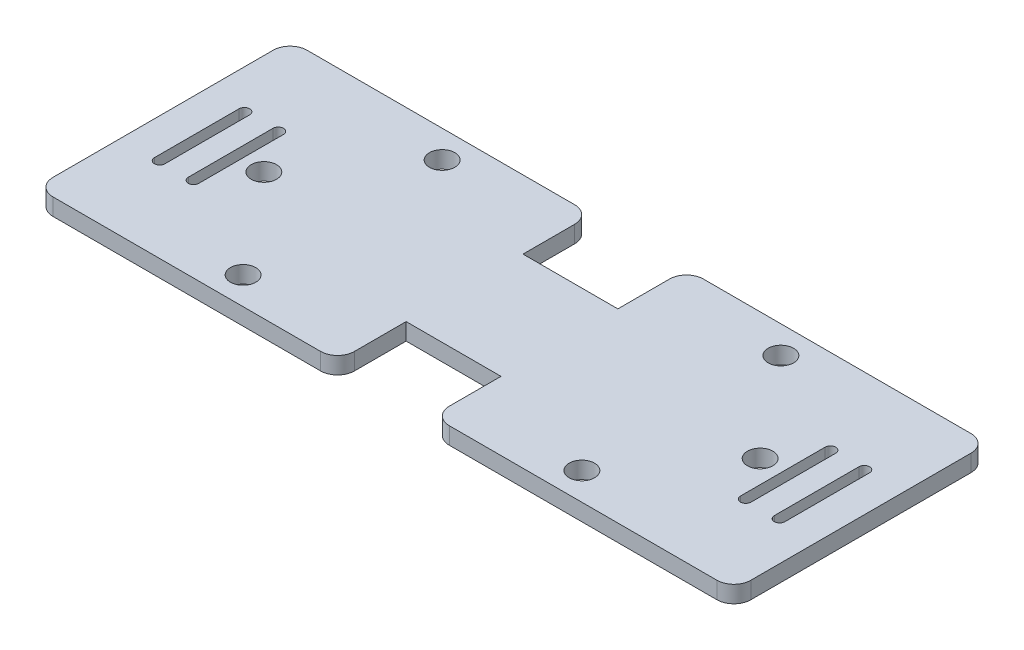
from build123d import *

# Parameters (mm, degrees)
SKETCH_1_R      = 1.5
EXTRUDE_1_DEPTH = 2


with BuildPart() as part:
    # 草图1 → 凸台-拉伸1 (new body)
    with BuildSketch(Plane(origin=(0, 0, 0), x_dir=(1, 0, 0), z_dir=(0, 1, 0))):
        with BuildLine():
            Line((-5.6, 6.9), (-5.6, 13))
            ThreePointArc((-5.6, 13), (-6.185786438, 14.414213562), (-7.6, 15))
            Line((-7.6, 15), (-39.2, 15))
            ThreePointArc((-39.2, 15), (-40.614213562, 14.414213562), (-41.2, 13))
            Line((-41.2, 13), (-41.2, -13))
            ThreePointArc((-41.2, -13), (-40.614213562, -14.414213562), (-39.2, -15))
            Line((-39.2, -15), (-7.6, -15))
            ThreePointArc((-7.6, -15), (-6.185786438, -14.414213562), (-5.6, -13))
            Line((-5.6, -13), (-5.6, -6.9))
            Line((-5.6, -6.9), (5.6, -6.9))
            Line((5.6, -6.9), (5.6, -13))
            ThreePointArc((5.6, -13), (6.185786438, -14.414213562), (7.6, -15))
            Line((7.6, -15), (39.2, -15))
            ThreePointArc((39.2, -15), (40.614213562, -14.414213562), (41.2, -13))
            Line((41.2, -13), (41.2, 13))
            ThreePointArc((41.2, 13), (40.614213562, 14.414213562), (39.2, 15))
            Line((39.2, 15), (7.6, 15))
            ThreePointArc((7.6, 15), (6.185786438, 14.414213562), (5.6, 13))
            Line((5.6, 13), (5.6, 6.9))
            Line((5.6, 6.9), (-5.6, 6.9))
        make_face()
        with Locations(Location((-20, -11.75, 0), (0, 0, 270))):
            Circle(SKETCH_1_R, mode=Mode.SUBTRACT)
        with Locations(Location((20, -11.75, 0), (0, 0, 270))):
            Circle(SKETCH_1_R, mode=Mode.SUBTRACT)
        with Locations(Location((20, 11.75, 0), (0, 0, 90))):
            Circle(SKETCH_1_R, mode=Mode.SUBTRACT)
        with Locations(Location((-20, 11.75, 0), (0, 0, 90))):
            Circle(SKETCH_1_R, mode=Mode.SUBTRACT)
        with Locations(Location((-29.3, 0, 0), (0, 0, 270))):
            Circle(SKETCH_1_R, mode=Mode.SUBTRACT)
        with Locations(Location((29.3, 0, 0), (0, 0, 270))):
            Circle(SKETCH_1_R, mode=Mode.SUBTRACT)
        with BuildLine():
            Line((33.225, 5), (33.225, -5))
            ThreePointArc((33.225, -5), (32.6, -5.625), (31.975, -5))
            Line((31.975, -5), (31.975, 5))
            ThreePointArc((31.975, 5), (32.6, 5.625), (33.225, 5))
        make_face(mode=Mode.SUBTRACT)
        with BuildLine():
            Line((37.225, 5), (37.225, -5))
            ThreePointArc((37.225, -5), (36.6, -5.625), (35.975, -5))
            Line((35.975, -5), (35.975, 5))
            ThreePointArc((35.975, 5), (36.6, 5.625), (37.225, 5))
        make_face(mode=Mode.SUBTRACT)
        with BuildLine():
            Line((-37.225, 5), (-37.225, -5))
            ThreePointArc((-37.225, -5), (-36.6, -5.625), (-35.975, -5))
            Line((-35.975, -5), (-35.975, 5))
            ThreePointArc((-35.975, 5), (-36.6, 5.625), (-37.225, 5))
        make_face(mode=Mode.SUBTRACT)
        with BuildLine():
            Line((-33.225, 5), (-33.225, -5))
            ThreePointArc((-33.225, -5), (-32.6, -5.625), (-31.975, -5))
            Line((-31.975, -5), (-31.975, 5))
            ThreePointArc((-31.975, 5), (-32.6, 5.625), (-33.225, 5))
        make_face(mode=Mode.SUBTRACT)
    extrude(amount=EXTRUDE_1_DEPTH)


solid = part.part
